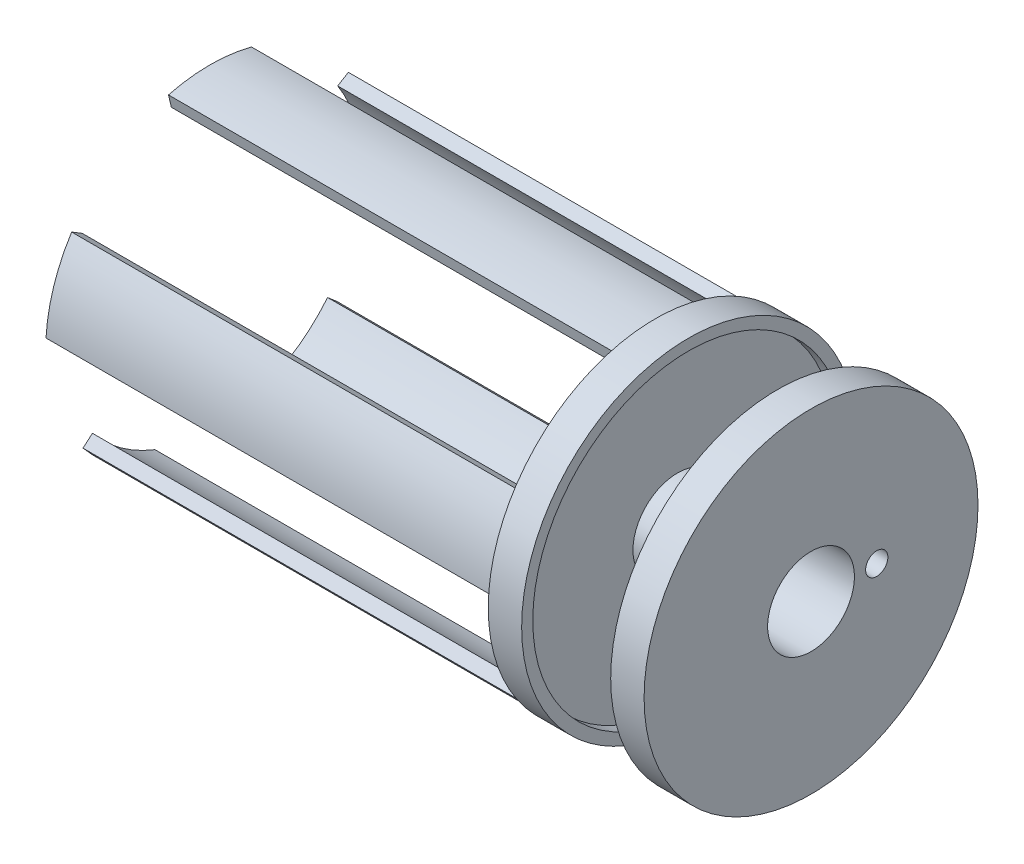
from build123d import *

# Parameters (mm, degrees)
SKETCH4_R           = 5
CUT_EXTRUDE4_DEPTH  = 16
BOSS_EXTRUDE1_DEPTH = 200
CIRPATTERN1_COUNT   = 5
SKETCH6_R           = 19.5
CUT_EXTRUDE5_DEPTH  = 291.086194087


with BuildPart() as part:
    # Sketch1 → Revolve2 (revolve)
    with BuildSketch(Plane.XY, mode=Mode.PRIVATE) as revolve2_sk:
        Polygon((-52.115384615, 0), (17.884615385, 0), (17.884615385, 75), (2.884615385, 75), (2.884615385, 70), (7.884615385, 70), (7.884615385, 20), (-42.115384615, 20), (-42.115384615, 70), (-37.115384615, 70), (-37.115384615, 75), (-52.115384615, 75), align=None)
    revolve(revolve2_sk.sketch.rotate(Axis((-114.1965821, 0, 0), (1, 0, 0)), 90), axis=Axis((-114.1965821, 0, 0), (1, 0, 0)))

    # Sketch4 → Cut-Extrude4 (cut)
    with BuildSketch(Plane(origin=(17.884615385, 0, 0), x_dir=(0, 0, -1), z_dir=(1, 0, 0))):
        with Locations((29.519700861, 0)):
            Circle(SKETCH4_R)
    extrude(amount=-CUT_EXTRUDE4_DEPTH, mode=Mode.SUBTRACT)

    # Sketch2 → Boss-Extrude1 (add)
    with BuildSketch(Plane.ZY.offset(52.115384615)):
        with BuildLine():
            Line((-18.650225291, 71.40454535), (-17.367191992, 65.951653826))
            ThreePointArc((-17.367191992, 65.951653826), (0, 68.2), (17.367191992, 65.951653826))
            Line((17.367191992, 65.951653826), (18.650225291, 71.40454535))
            ThreePointArc((18.650225291, 71.40454535), (0, 73.8), (-18.650225291, 71.40454535))
        make_face()
    boss_extrude1 = extrude(amount=BOSS_EXTRUDE1_DEPTH)

    # CirPattern1: Boss-Extrude1 ×5 about axis
    cirpattern1_axis = Axis((0, 0, 0), (1, 0, 0))
    for i in range(1, CIRPATTERN1_COUNT):
        add(boss_extrude1.rotate(cirpattern1_axis, i * 360 / CIRPATTERN1_COUNT))

    # Sketch6 → Cut-Extrude5 (cut, through all)
    with BuildSketch(Plane(origin=(17.884615385, 0, 0), x_dir=(0, 0, -1), z_dir=(1, 0, 0))):
        Circle(SKETCH6_R)
    extrude(amount=-CUT_EXTRUDE5_DEPTH, mode=Mode.SUBTRACT)


solid = part.part
